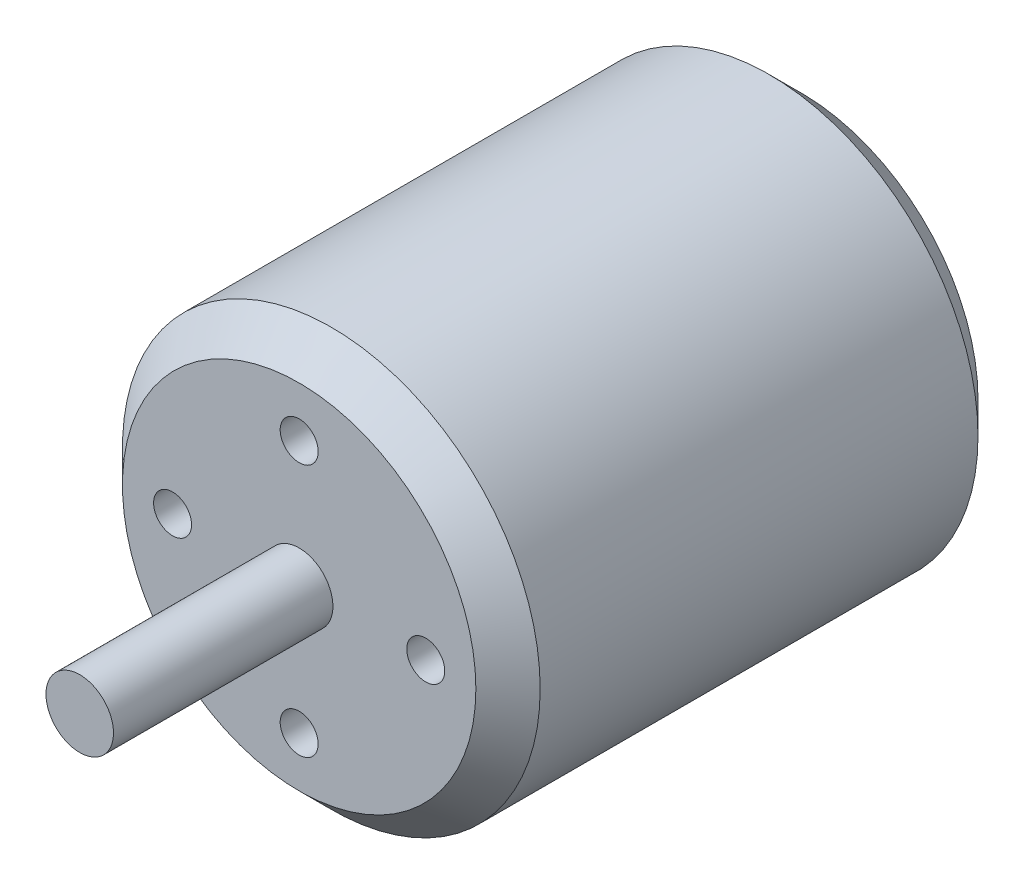
from build123d import *

# Parameters (mm, degrees)
SKETCH1_R           = 24.75
BOSS_EXTRUDE1_DEPTH = 59.5
SKETCH2_R           = 4
BOSS_EXTRUDE2_DEPTH = 26
CHAMFER1_SIZE       = 3.81
CHAMFER2_SIZE       = 3.81
SKETCH3_R           = 2.25
CUT_EXTRUDE3_DEPTH  = 12.7


with BuildPart() as part:
    # Sketch1 → Boss-Extrude1 (new body)
    with BuildSketch(Plane.XY):
        Circle(SKETCH1_R)
    extrude(amount=BOSS_EXTRUDE1_DEPTH)

    # Sketch2 → Boss-Extrude2 (add)
    with BuildSketch(Plane.XY.offset(59.5)):
        with Locations(Location((0, 0, 0), (0, 0, 180))):
            Circle(SKETCH2_R)
    extrude(amount=BOSS_EXTRUDE2_DEPTH)

    # Chamfer1
    chamfer1_edges = [part.edges().sort_by_distance(p)[0] for p in [
        (-24.75, 0, 59.5),
    ]]
    chamfer(chamfer1_edges, length=CHAMFER1_SIZE)

    # Chamfer2
    chamfer2_edges = [part.edges().sort_by_distance(p)[0] for p in [
        (-24.75, 0, 0),
    ]]
    chamfer(chamfer2_edges, length=CHAMFER2_SIZE)

    # Sketch3 → Cut-Extrude3 (cut)
    with BuildSketch(Plane.XY.offset(59.5)):
        with Locations((0, 15)):
            Circle(SKETCH3_R)
        with Locations((15, 0)):
            Circle(SKETCH3_R)
        with Locations((0, -15)):
            Circle(SKETCH3_R)
        with Locations((-15, 0)):
            Circle(SKETCH3_R)
    extrude(amount=-CUT_EXTRUDE3_DEPTH, mode=Mode.SUBTRACT)


solid = part.part
